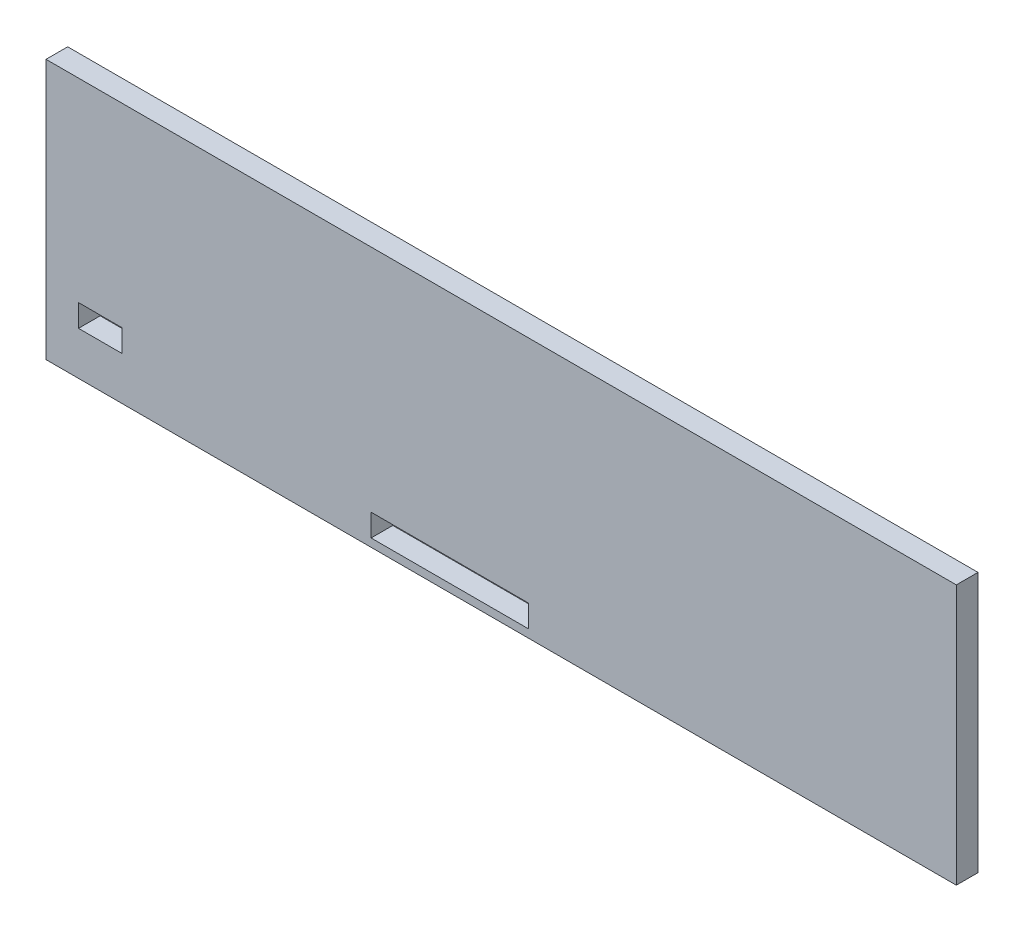
from build123d import *

# Parameters (mm, degrees)
SKETCH1_W           = 533.4
SKETCH1_H           = 152.4
BOSS_EXTRUDE1_DEPTH = 12.7
SKETCH2_W           = 25.4
SKETCH2_H           = 13.081
CUT_EXTRUDE1_DEPTH  = 555.889727784
SKETCH3_W           = 92.202
SKETCH3_H           = 13.081
CUT_EXTRUDE2_DEPTH  = 555.889727784


with BuildPart() as part:
    # Sketch1 → Boss-Extrude1 (new body)
    with BuildSketch(Plane.XY):
        with Locations((266.7, 76.2)):
            Rectangle(SKETCH1_W, SKETCH1_H)
    extrude(amount=BOSS_EXTRUDE1_DEPTH)

    # Sketch2 → Cut-Extrude1 (cut, through all)
    with BuildSketch(Plane.XY):
        with Locations((31.75, 31.9405)):
            Rectangle(SKETCH2_W, SKETCH2_H)
    extrude(amount=CUT_EXTRUDE1_DEPTH, mode=Mode.SUBTRACT)

    # Sketch3 → Cut-Extrude2 (cut, through all)
    with BuildSketch(Plane.XY):
        with Locations((236.601, 11.2903)):
            Rectangle(SKETCH3_W, SKETCH3_H)
    extrude(amount=CUT_EXTRUDE2_DEPTH, mode=Mode.SUBTRACT)


solid = part.part
